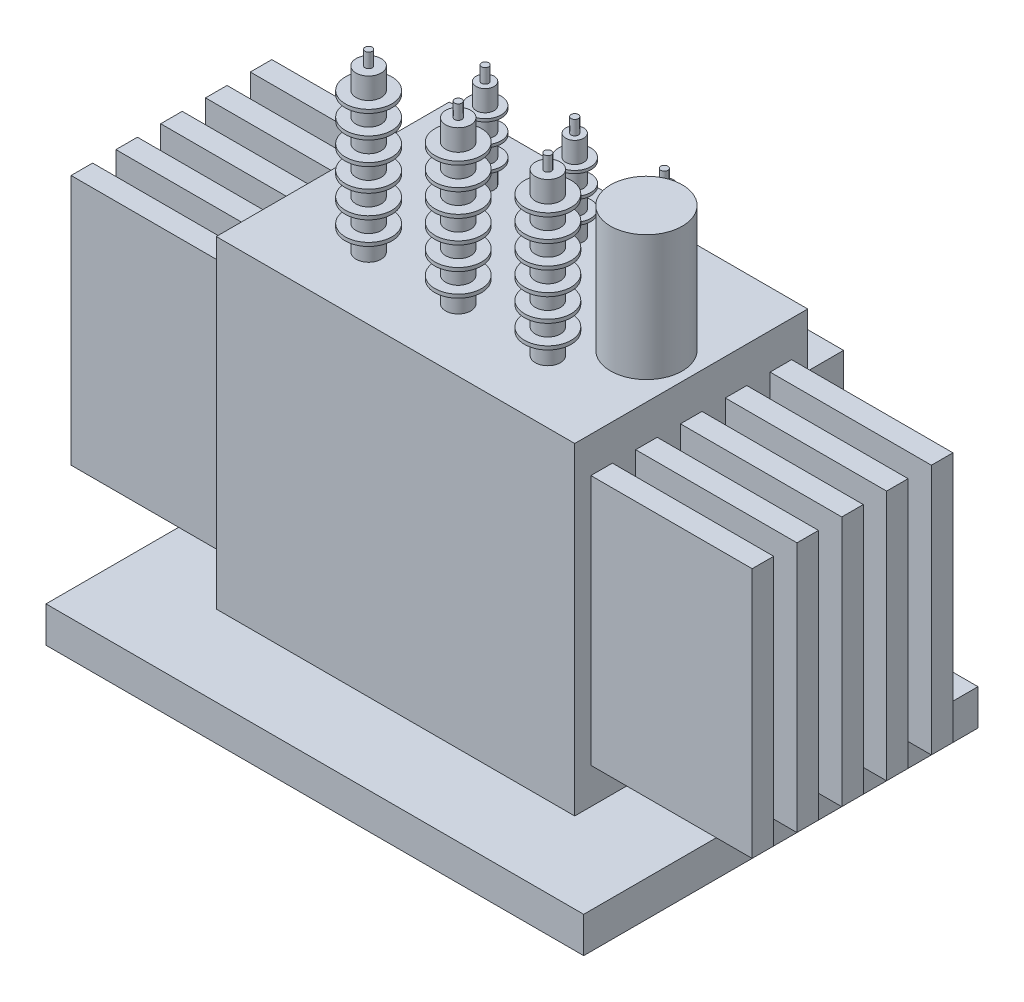
from build123d import *

# Parameters (mm, degrees)
SKETCH1_W             = 3000
SKETCH1_H             = 2200
PAD_DEPTH             = 200
MAIN_START            = 200
SKETCH2_W             = 2000
SKETCH2_H             = 1300
MAIN_TANK_DEPTH       = 1800
RADIATOR_START        = 400
SKETCH3_W             = 900
SKETCH3_H             = 120
RADIATOR_X_1_DEPTH    = 1400
SKETCH4_W             = 900
SKETCH4_H             = 120
RADIATOR_X_1_2_DEPTH  = 1400
SKETCH5_W             = 900
SKETCH5_H             = 120
RADIATOR_X_2_DEPTH    = 1400
SKETCH6_W             = 900
SKETCH6_H             = 120
RADIATOR_X_2_2_DEPTH  = 1400
SKETCH7_W             = 900
SKETCH7_H             = 120
RADIATOR_X_3_DEPTH    = 1400
SKETCH8_W             = 900
SKETCH8_H             = 120
RADIATOR_X_3_2_DEPTH  = 1400
SKETCH9_W             = 900
SKETCH9_H             = 120
RADIATOR_X_4_DEPTH    = 1400
SKETCH10_W            = 900
SKETCH10_H            = 120
RADIATOR_X_4_2_DEPTH  = 1400
SKETCH11_W            = 900
SKETCH11_H            = 120
RADIATOR_X_5_DEPTH    = 1400
SKETCH12_W            = 900
SKETCH12_H            = 120
RADIATOR_X_5_2_DEPTH  = 1400
BUSHING_START         = 2000
SKETCH13_R            = 70
BUSHING_HV_1_DEPTH    = 900
SHED_START            = 2118.571428571
SKETCH14_R            = 130
SHED_HV_1_1_DEPTH     = 20
SHED_START_2          = 2247.142857143
SKETCH15_R            = 130
SHED_HV_1_2_DEPTH     = 20
SHED_START_3          = 2375.714285714
SKETCH16_R            = 130
SHED_HV_1_3_DEPTH     = 20
SHED_START_4          = 2504.285714286
SKETCH17_R            = 130
SHED_HV_1_4_DEPTH     = 20
SHED_START_5          = 2632.857142857
SKETCH18_R            = 130
SHED_HV_1_5_DEPTH     = 20
SHED_START_6          = 2761.428571429
SKETCH19_R            = 130
SHED_HV_1_6_DEPTH     = 20
TERMINAL_START        = 2900
SKETCH20_R            = 20
TERMINAL_HV_1_DEPTH   = 80
SKETCH21_R            = 70
BUSHING_HV_2_DEPTH    = 900
SKETCH22_R            = 130
SHED_HV_2_1_DEPTH     = 20
SKETCH23_R            = 130
SHED_HV_2_2_DEPTH     = 20
SKETCH24_R            = 130
SHED_HV_2_3_DEPTH     = 20
SKETCH25_R            = 130
SHED_HV_2_4_DEPTH     = 20
SKETCH26_R            = 130
SHED_HV_2_5_DEPTH     = 20
SKETCH27_R            = 130
SHED_HV_2_6_DEPTH     = 20
SKETCH28_R            = 20
TERMINAL_HV_2_DEPTH   = 80
SKETCH29_R            = 70
BUSHING_HV_3_DEPTH    = 900
SKETCH30_R            = 130
SHED_HV_3_1_DEPTH     = 20
SKETCH31_R            = 130
SHED_HV_3_2_DEPTH     = 20
SKETCH32_R            = 130
SHED_HV_3_3_DEPTH     = 20
SKETCH33_R            = 130
SHED_HV_3_4_DEPTH     = 20
SKETCH34_R            = 130
SHED_HV_3_5_DEPTH     = 20
SKETCH35_R            = 130
SHED_HV_3_6_DEPTH     = 20
SKETCH36_R            = 20
TERMINAL_HV_3_DEPTH   = 80
SKETCH37_R            = 50
BUSHING_LV_1_DEPTH    = 500
SHED_START_7          = 2117
SKETCH38_R            = 90
SHED_LV_1_1_DEPTH     = 16
SHED_START_8          = 2242
SKETCH39_R            = 90
SHED_LV_1_2_DEPTH     = 16
SHED_START_9          = 2367
SKETCH40_R            = 90
SHED_LV_1_3_DEPTH     = 16
TERMINAL_START_2      = 2500
SKETCH41_R            = 20
TERMINAL_LV_1_DEPTH   = 80
SKETCH42_R            = 50
BUSHING_LV_2_DEPTH    = 500
SKETCH43_R            = 90
SHED_LV_2_1_DEPTH     = 16
SKETCH44_R            = 90
SHED_LV_2_2_DEPTH     = 16
SKETCH45_R            = 90
SHED_LV_2_3_DEPTH     = 16
SKETCH46_R            = 20
TERMINAL_LV_2_DEPTH   = 80
SKETCH47_R            = 50
BUSHING_LV_3_DEPTH    = 500
SKETCH48_R            = 90
SHED_LV_3_1_DEPTH     = 16
SKETCH49_R            = 90
SHED_LV_3_2_DEPTH     = 16
SKETCH50_R            = 90
SHED_LV_3_3_DEPTH     = 16
SKETCH51_R            = 20
TERMINAL_LV_3_DEPTH   = 80
CONSERVATOR_START     = 2000
SKETCH52_R            = 200
CONSERVATOR_DEPTH     = 700
CONTROL_START         = 500
SKETCH53_W            = 600
SKETCH53_H            = 400
CONTROL_CABINET_DEPTH = 1000


with BuildPart() as part:
    # Sketch1 → Pad (new body)
    with BuildSketch(Plane(origin=(0, 0, 0), x_dir=(1, 0, 0), z_dir=(0, 1, 0))):
        Rectangle(SKETCH1_W, SKETCH1_H)
    extrude(amount=PAD_DEPTH)


with BuildPart() as body_2:
    # Sketch2 → Main tank (new body)
    with BuildSketch(Plane(origin=(0, 0, 0), x_dir=(1, 0, 0), z_dir=(0, 1, 0)).offset(MAIN_START)):
        Rectangle(SKETCH2_W, SKETCH2_H)
    extrude(amount=MAIN_TANK_DEPTH)


with BuildPart() as body_3:
    # Sketch3 → Radiator _x 1 (new body)
    with BuildSketch(Plane(origin=(0, 0, 0), x_dir=(1, 0, 0), z_dir=(0, 1, 0)).offset(RADIATOR_START)):
        with Locations((1450, 500)):
            Rectangle(SKETCH3_W, SKETCH3_H)
    extrude(amount=RADIATOR_X_1_DEPTH)


with BuildPart() as body_4:
    # Sketch4 → Radiator -x 1 2 (new body)
    with BuildSketch(Plane(origin=(0, 0, 0), x_dir=(1, 0, 0), z_dir=(0, 1, 0)).offset(RADIATOR_START)):
        with Locations((-1450, 500)):
            Rectangle(SKETCH4_W, SKETCH4_H)
    extrude(amount=RADIATOR_X_1_2_DEPTH)


with BuildPart() as body_5:
    # Sketch5 → Radiator _x 2 (new body)
    with BuildSketch(Plane(origin=(0, 0, 0), x_dir=(1, 0, 0), z_dir=(0, 1, 0)).offset(RADIATOR_START)):
        with Locations((1450, 250)):
            Rectangle(SKETCH5_W, SKETCH5_H)
    extrude(amount=RADIATOR_X_2_DEPTH)


with BuildPart() as body_6:
    # Sketch6 → Radiator -x 2 2 (new body)
    with BuildSketch(Plane(origin=(0, 0, 0), x_dir=(1, 0, 0), z_dir=(0, 1, 0)).offset(RADIATOR_START)):
        with Locations((-1450, 250)):
            Rectangle(SKETCH6_W, SKETCH6_H)
    extrude(amount=RADIATOR_X_2_2_DEPTH)


with BuildPart() as body_7:
    # Sketch7 → Radiator _x 3 (new body)
    with BuildSketch(Plane(origin=(0, 0, 0), x_dir=(1, 0, 0), z_dir=(0, 1, 0)).offset(RADIATOR_START)):
        with Locations((1450, 0)):
            Rectangle(SKETCH7_W, SKETCH7_H)
    extrude(amount=RADIATOR_X_3_DEPTH)


with BuildPart() as body_8:
    # Sketch8 → Radiator -x 3 2 (new body)
    with BuildSketch(Plane(origin=(0, 0, 0), x_dir=(1, 0, 0), z_dir=(0, 1, 0)).offset(RADIATOR_START)):
        with Locations((-1450, 0)):
            Rectangle(SKETCH8_W, SKETCH8_H)
    extrude(amount=RADIATOR_X_3_2_DEPTH)


with BuildPart() as body_9:
    # Sketch9 → Radiator _x 4 (new body)
    with BuildSketch(Plane(origin=(0, 0, 0), x_dir=(1, 0, 0), z_dir=(0, 1, 0)).offset(RADIATOR_START)):
        with Locations((1450, -250)):
            Rectangle(SKETCH9_W, SKETCH9_H)
    extrude(amount=RADIATOR_X_4_DEPTH)


with BuildPart() as body_10:
    # Sketch10 → Radiator -x 4 2 (new body)
    with BuildSketch(Plane(origin=(0, 0, 0), x_dir=(1, 0, 0), z_dir=(0, 1, 0)).offset(RADIATOR_START)):
        with Locations((-1450, -250)):
            Rectangle(SKETCH10_W, SKETCH10_H)
    extrude(amount=RADIATOR_X_4_2_DEPTH)


with BuildPart() as body_11:
    # Sketch11 → Radiator _x 5 (new body)
    with BuildSketch(Plane(origin=(0, 0, 0), x_dir=(1, 0, 0), z_dir=(0, 1, 0)).offset(RADIATOR_START)):
        with Locations((1450, -500)):
            Rectangle(SKETCH11_W, SKETCH11_H)
    extrude(amount=RADIATOR_X_5_DEPTH)


with BuildPart() as body_12:
    # Sketch12 → Radiator -x 5 2 (new body)
    with BuildSketch(Plane(origin=(0, 0, 0), x_dir=(1, 0, 0), z_dir=(0, 1, 0)).offset(RADIATOR_START)):
        with Locations((-1450, -500)):
            Rectangle(SKETCH12_W, SKETCH12_H)
    extrude(amount=RADIATOR_X_5_2_DEPTH)


with BuildPart() as body_13:
    # Sketch13 → Bushing HV 1 (new body)
    with BuildSketch(Plane(origin=(0, 0, 0), x_dir=(1, 0, 0), z_dir=(0, 1, 0)).offset(BUSHING_START)):
        with Locations(Location((-500, -300, 0), (0, 0, 270))):
            Circle(SKETCH13_R)
    extrude(amount=BUSHING_HV_1_DEPTH)


with BuildPart() as body_14:
    # Sketch14 → Shed HV 1 1 (new body)
    with BuildSketch(Plane(origin=(0, 0, 0), x_dir=(1, 0, 0), z_dir=(0, 1, 0)).offset(SHED_START)):
        with Locations(Location((-500, -300, 0), (0, 0, 270))):
            Circle(SKETCH14_R)
    extrude(amount=SHED_HV_1_1_DEPTH)


with BuildPart() as body_15:
    # Sketch15 → Shed HV 1 2 (new body)
    with BuildSketch(Plane(origin=(0, 0, 0), x_dir=(1, 0, 0), z_dir=(0, 1, 0)).offset(SHED_START_2)):
        with Locations(Location((-500, -300, 0), (0, 0, 270))):
            Circle(SKETCH15_R)
    extrude(amount=SHED_HV_1_2_DEPTH)


with BuildPart() as body_16:
    # Sketch16 → Shed HV 1 3 (new body)
    with BuildSketch(Plane(origin=(0, 0, 0), x_dir=(1, 0, 0), z_dir=(0, 1, 0)).offset(SHED_START_3)):
        with Locations(Location((-500, -300, 0), (0, 0, 270))):
            Circle(SKETCH16_R)
    extrude(amount=SHED_HV_1_3_DEPTH)


with BuildPart() as body_17:
    # Sketch17 → Shed HV 1 4 (new body)
    with BuildSketch(Plane(origin=(0, 0, 0), x_dir=(1, 0, 0), z_dir=(0, 1, 0)).offset(SHED_START_4)):
        with Locations(Location((-500, -300, 0), (0, 0, 270))):
            Circle(SKETCH17_R)
    extrude(amount=SHED_HV_1_4_DEPTH)


with BuildPart() as body_18:
    # Sketch18 → Shed HV 1 5 (new body)
    with BuildSketch(Plane(origin=(0, 0, 0), x_dir=(1, 0, 0), z_dir=(0, 1, 0)).offset(SHED_START_5)):
        with Locations(Location((-500, -300, 0), (0, 0, 270))):
            Circle(SKETCH18_R)
    extrude(amount=SHED_HV_1_5_DEPTH)


with BuildPart() as body_19:
    # Sketch19 → Shed HV 1 6 (new body)
    with BuildSketch(Plane(origin=(0, 0, 0), x_dir=(1, 0, 0), z_dir=(0, 1, 0)).offset(SHED_START_6)):
        with Locations(Location((-500, -300, 0), (0, 0, 270))):
            Circle(SKETCH19_R)
    extrude(amount=SHED_HV_1_6_DEPTH)


with BuildPart() as body_20:
    # Sketch20 → Terminal HV 1 (new body)
    with BuildSketch(Plane(origin=(0, 0, 0), x_dir=(1, 0, 0), z_dir=(0, 1, 0)).offset(TERMINAL_START)):
        with Locations(Location((-500, -300, 0), (0, 0, 270))):
            Circle(SKETCH20_R)
    extrude(amount=TERMINAL_HV_1_DEPTH)


with BuildPart() as body_21:
    # Sketch21 → Bushing HV 2 (new body)
    with BuildSketch(Plane(origin=(0, 0, 0), x_dir=(1, 0, 0), z_dir=(0, 1, 0)).offset(BUSHING_START)):
        with Locations(Location((0, -300, 0), (0, 0, 270))):
            Circle(SKETCH21_R)
    extrude(amount=BUSHING_HV_2_DEPTH)


with BuildPart() as body_22:
    # Sketch22 → Shed HV 2 1 (new body)
    with BuildSketch(Plane(origin=(0, 0, 0), x_dir=(1, 0, 0), z_dir=(0, 1, 0)).offset(SHED_START)):
        with Locations(Location((0, -300, 0), (0, 0, 270))):
            Circle(SKETCH22_R)
    extrude(amount=SHED_HV_2_1_DEPTH)


with BuildPart() as body_23:
    # Sketch23 → Shed HV 2 2 (new body)
    with BuildSketch(Plane(origin=(0, 0, 0), x_dir=(1, 0, 0), z_dir=(0, 1, 0)).offset(SHED_START_2)):
        with Locations(Location((0, -300, 0), (0, 0, 270))):
            Circle(SKETCH23_R)
    extrude(amount=SHED_HV_2_2_DEPTH)


with BuildPart() as body_24:
    # Sketch24 → Shed HV 2 3 (new body)
    with BuildSketch(Plane(origin=(0, 0, 0), x_dir=(1, 0, 0), z_dir=(0, 1, 0)).offset(SHED_START_3)):
        with Locations(Location((0, -300, 0), (0, 0, 270))):
            Circle(SKETCH24_R)
    extrude(amount=SHED_HV_2_3_DEPTH)


with BuildPart() as body_25:
    # Sketch25 → Shed HV 2 4 (new body)
    with BuildSketch(Plane(origin=(0, 0, 0), x_dir=(1, 0, 0), z_dir=(0, 1, 0)).offset(SHED_START_4)):
        with Locations(Location((0, -300, 0), (0, 0, 270))):
            Circle(SKETCH25_R)
    extrude(amount=SHED_HV_2_4_DEPTH)


with BuildPart() as body_26:
    # Sketch26 → Shed HV 2 5 (new body)
    with BuildSketch(Plane(origin=(0, 0, 0), x_dir=(1, 0, 0), z_dir=(0, 1, 0)).offset(SHED_START_5)):
        with Locations(Location((0, -300, 0), (0, 0, 270))):
            Circle(SKETCH26_R)
    extrude(amount=SHED_HV_2_5_DEPTH)


with BuildPart() as body_27:
    # Sketch27 → Shed HV 2 6 (new body)
    with BuildSketch(Plane(origin=(0, 0, 0), x_dir=(1, 0, 0), z_dir=(0, 1, 0)).offset(SHED_START_6)):
        with Locations(Location((0, -300, 0), (0, 0, 270))):
            Circle(SKETCH27_R)
    extrude(amount=SHED_HV_2_6_DEPTH)


with BuildPart() as body_28:
    # Sketch28 → Terminal HV 2 (new body)
    with BuildSketch(Plane(origin=(0, 0, 0), x_dir=(1, 0, 0), z_dir=(0, 1, 0)).offset(TERMINAL_START)):
        with Locations(Location((0, -300, 0), (0, 0, 270))):
            Circle(SKETCH28_R)
    extrude(amount=TERMINAL_HV_2_DEPTH)


with BuildPart() as body_29:
    # Sketch29 → Bushing HV 3 (new body)
    with BuildSketch(Plane(origin=(0, 0, 0), x_dir=(1, 0, 0), z_dir=(0, 1, 0)).offset(BUSHING_START)):
        with Locations(Location((500, -300, 0), (0, 0, 270))):
            Circle(SKETCH29_R)
    extrude(amount=BUSHING_HV_3_DEPTH)


with BuildPart() as body_30:
    # Sketch30 → Shed HV 3 1 (new body)
    with BuildSketch(Plane(origin=(0, 0, 0), x_dir=(1, 0, 0), z_dir=(0, 1, 0)).offset(SHED_START)):
        with Locations(Location((500, -300, 0), (0, 0, 270))):
            Circle(SKETCH30_R)
    extrude(amount=SHED_HV_3_1_DEPTH)


with BuildPart() as body_31:
    # Sketch31 → Shed HV 3 2 (new body)
    with BuildSketch(Plane(origin=(0, 0, 0), x_dir=(1, 0, 0), z_dir=(0, 1, 0)).offset(SHED_START_2)):
        with Locations(Location((500, -300, 0), (0, 0, 270))):
            Circle(SKETCH31_R)
    extrude(amount=SHED_HV_3_2_DEPTH)


with BuildPart() as body_32:
    # Sketch32 → Shed HV 3 3 (new body)
    with BuildSketch(Plane(origin=(0, 0, 0), x_dir=(1, 0, 0), z_dir=(0, 1, 0)).offset(SHED_START_3)):
        with Locations(Location((500, -300, 0), (0, 0, 270))):
            Circle(SKETCH32_R)
    extrude(amount=SHED_HV_3_3_DEPTH)


with BuildPart() as body_33:
    # Sketch33 → Shed HV 3 4 (new body)
    with BuildSketch(Plane(origin=(0, 0, 0), x_dir=(1, 0, 0), z_dir=(0, 1, 0)).offset(SHED_START_4)):
        with Locations(Location((500, -300, 0), (0, 0, 270))):
            Circle(SKETCH33_R)
    extrude(amount=SHED_HV_3_4_DEPTH)


with BuildPart() as body_34:
    # Sketch34 → Shed HV 3 5 (new body)
    with BuildSketch(Plane(origin=(0, 0, 0), x_dir=(1, 0, 0), z_dir=(0, 1, 0)).offset(SHED_START_5)):
        with Locations(Location((500, -300, 0), (0, 0, 270))):
            Circle(SKETCH34_R)
    extrude(amount=SHED_HV_3_5_DEPTH)


with BuildPart() as body_35:
    # Sketch35 → Shed HV 3 6 (new body)
    with BuildSketch(Plane(origin=(0, 0, 0), x_dir=(1, 0, 0), z_dir=(0, 1, 0)).offset(SHED_START_6)):
        with Locations(Location((500, -300, 0), (0, 0, 270))):
            Circle(SKETCH35_R)
    extrude(amount=SHED_HV_3_6_DEPTH)


with BuildPart() as body_36:
    # Sketch36 → Terminal HV 3 (new body)
    with BuildSketch(Plane(origin=(0, 0, 0), x_dir=(1, 0, 0), z_dir=(0, 1, 0)).offset(TERMINAL_START)):
        with Locations(Location((500, -300, 0), (0, 0, 270))):
            Circle(SKETCH36_R)
    extrude(amount=TERMINAL_HV_3_DEPTH)


with BuildPart() as body_37:
    # Sketch37 → Bushing LV 1 (new body)
    with BuildSketch(Plane(origin=(0, 0, 0), x_dir=(1, 0, 0), z_dir=(0, 1, 0)).offset(BUSHING_START)):
        with Locations(Location((-500, 350, 0), (0, 0, 270))):
            Circle(SKETCH37_R)
    extrude(amount=BUSHING_LV_1_DEPTH)


with BuildPart() as body_38:
    # Sketch38 → Shed LV 1 1 (new body)
    with BuildSketch(Plane(origin=(0, 0, 0), x_dir=(1, 0, 0), z_dir=(0, 1, 0)).offset(SHED_START_7)):
        with Locations(Location((-500, 350, 0), (0, 0, 270))):
            Circle(SKETCH38_R)
    extrude(amount=SHED_LV_1_1_DEPTH)


with BuildPart() as body_39:
    # Sketch39 → Shed LV 1 2 (new body)
    with BuildSketch(Plane(origin=(0, 0, 0), x_dir=(1, 0, 0), z_dir=(0, 1, 0)).offset(SHED_START_8)):
        with Locations(Location((-500, 350, 0), (0, 0, 270))):
            Circle(SKETCH39_R)
    extrude(amount=SHED_LV_1_2_DEPTH)


with BuildPart() as body_40:
    # Sketch40 → Shed LV 1 3 (new body)
    with BuildSketch(Plane(origin=(0, 0, 0), x_dir=(1, 0, 0), z_dir=(0, 1, 0)).offset(SHED_START_9)):
        with Locations(Location((-500, 350, 0), (0, 0, 270))):
            Circle(SKETCH40_R)
    extrude(amount=SHED_LV_1_3_DEPTH)


with BuildPart() as body_41:
    # Sketch41 → Terminal LV 1 (new body)
    with BuildSketch(Plane(origin=(0, 0, 0), x_dir=(1, 0, 0), z_dir=(0, 1, 0)).offset(TERMINAL_START_2)):
        with Locations(Location((-500, 350, 0), (0, 0, 270))):
            Circle(SKETCH41_R)
    extrude(amount=TERMINAL_LV_1_DEPTH)


with BuildPart() as body_42:
    # Sketch42 → Bushing LV 2 (new body)
    with BuildSketch(Plane(origin=(0, 0, 0), x_dir=(1, 0, 0), z_dir=(0, 1, 0)).offset(BUSHING_START)):
        with Locations(Location((0, 350, 0), (0, 0, 270))):
            Circle(SKETCH42_R)
    extrude(amount=BUSHING_LV_2_DEPTH)


with BuildPart() as body_43:
    # Sketch43 → Shed LV 2 1 (new body)
    with BuildSketch(Plane(origin=(0, 0, 0), x_dir=(1, 0, 0), z_dir=(0, 1, 0)).offset(SHED_START_7)):
        with Locations(Location((0, 350, 0), (0, 0, 270))):
            Circle(SKETCH43_R)
    extrude(amount=SHED_LV_2_1_DEPTH)


with BuildPart() as body_44:
    # Sketch44 → Shed LV 2 2 (new body)
    with BuildSketch(Plane(origin=(0, 0, 0), x_dir=(1, 0, 0), z_dir=(0, 1, 0)).offset(SHED_START_8)):
        with Locations(Location((0, 350, 0), (0, 0, 270))):
            Circle(SKETCH44_R)
    extrude(amount=SHED_LV_2_2_DEPTH)


with BuildPart() as body_45:
    # Sketch45 → Shed LV 2 3 (new body)
    with BuildSketch(Plane(origin=(0, 0, 0), x_dir=(1, 0, 0), z_dir=(0, 1, 0)).offset(SHED_START_9)):
        with Locations(Location((0, 350, 0), (0, 0, 270))):
            Circle(SKETCH45_R)
    extrude(amount=SHED_LV_2_3_DEPTH)


with BuildPart() as body_46:
    # Sketch46 → Terminal LV 2 (new body)
    with BuildSketch(Plane(origin=(0, 0, 0), x_dir=(1, 0, 0), z_dir=(0, 1, 0)).offset(TERMINAL_START_2)):
        with Locations(Location((0, 350, 0), (0, 0, 270))):
            Circle(SKETCH46_R)
    extrude(amount=TERMINAL_LV_2_DEPTH)


with BuildPart() as body_47:
    # Sketch47 → Bushing LV 3 (new body)
    with BuildSketch(Plane(origin=(0, 0, 0), x_dir=(1, 0, 0), z_dir=(0, 1, 0)).offset(BUSHING_START)):
        with Locations(Location((500, 350, 0), (0, 0, 270))):
            Circle(SKETCH47_R)
    extrude(amount=BUSHING_LV_3_DEPTH)


with BuildPart() as body_48:
    # Sketch48 → Shed LV 3 1 (new body)
    with BuildSketch(Plane(origin=(0, 0, 0), x_dir=(1, 0, 0), z_dir=(0, 1, 0)).offset(SHED_START_7)):
        with Locations(Location((500, 350, 0), (0, 0, 270))):
            Circle(SKETCH48_R)
    extrude(amount=SHED_LV_3_1_DEPTH)


with BuildPart() as body_49:
    # Sketch49 → Shed LV 3 2 (new body)
    with BuildSketch(Plane(origin=(0, 0, 0), x_dir=(1, 0, 0), z_dir=(0, 1, 0)).offset(SHED_START_8)):
        with Locations(Location((500, 350, 0), (0, 0, 270))):
            Circle(SKETCH49_R)
    extrude(amount=SHED_LV_3_2_DEPTH)


with BuildPart() as body_50:
    # Sketch50 → Shed LV 3 3 (new body)
    with BuildSketch(Plane(origin=(0, 0, 0), x_dir=(1, 0, 0), z_dir=(0, 1, 0)).offset(SHED_START_9)):
        with Locations(Location((500, 350, 0), (0, 0, 270))):
            Circle(SKETCH50_R)
    extrude(amount=SHED_LV_3_3_DEPTH)


with BuildPart() as body_51:
    # Sketch51 → Terminal LV 3 (new body)
    with BuildSketch(Plane(origin=(0, 0, 0), x_dir=(1, 0, 0), z_dir=(0, 1, 0)).offset(TERMINAL_START_2)):
        with Locations(Location((500, 350, 0), (0, 0, 270))):
            Circle(SKETCH51_R)
    extrude(amount=TERMINAL_LV_3_DEPTH)


with BuildPart() as body_52:
    # Sketch52 → Conservator (new body)
    with BuildSketch(Plane(origin=(0, 0, 0), x_dir=(1, 0, 0), z_dir=(0, 1, 0)).offset(CONSERVATOR_START)):
        with Locations(Location((750, 0, 0), (0, 0, 270))):
            Circle(SKETCH52_R)
    extrude(amount=CONSERVATOR_DEPTH)


with BuildPart() as body_53:
    # Sketch53 → Control cabinet (new body)
    with BuildSketch(Plane(origin=(0, 0, 0), x_dir=(1, 0, 0), z_dir=(0, 1, 0)).offset(CONTROL_START)):
        with Locations((500, 850)):
            Rectangle(SKETCH53_W, SKETCH53_H)
    extrude(amount=CONTROL_CABINET_DEPTH)


solid = Compound([part.part, body_2.part, body_3.part, body_4.part, body_5.part, body_6.part, body_7.part, body_8.part, body_9.part, body_10.part, body_11.part, body_12.part, body_13.part, body_14.part, body_15.part, body_16.part, body_17.part, body_18.part, body_19.part, body_20.part, body_21.part, body_22.part, body_23.part, body_24.part, body_25.part, body_26.part, body_27.part, body_28.part, body_29.part, body_30.part, body_31.part, body_32.part, body_33.part, body_34.part, body_35.part, body_36.part, body_37.part, body_38.part, body_39.part, body_40.part, body_41.part, body_42.part, body_43.part, body_44.part, body_45.part, body_46.part, body_47.part, body_48.part, body_49.part, body_50.part, body_51.part, body_52.part, body_53.part])
